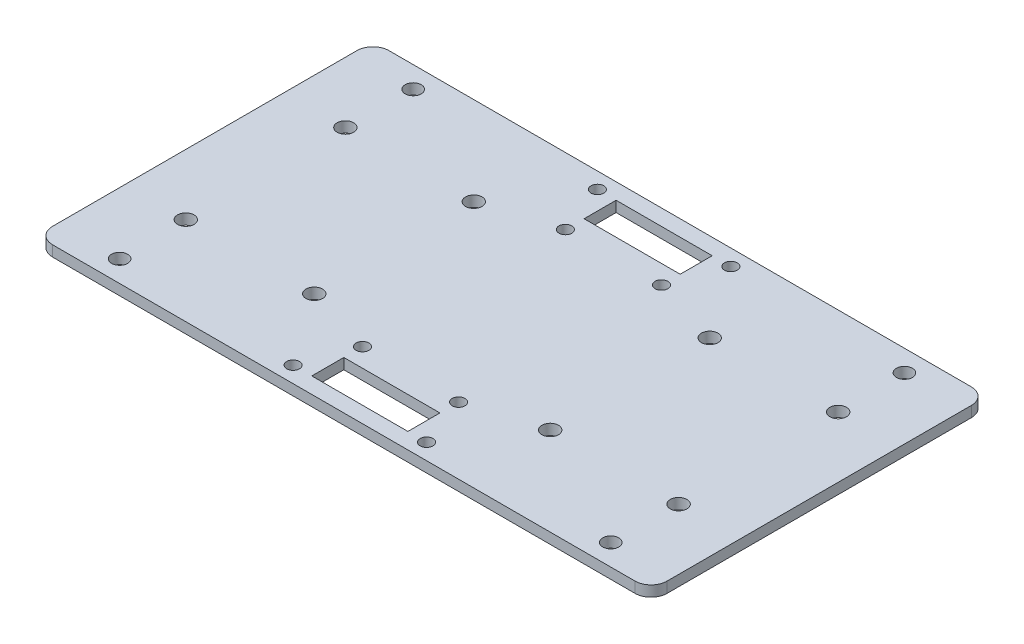
from build123d import *

# Parameters (mm, degrees)
ESBO_O1_W                = 115.09677689
ESBO_O1_H                = 63
RESSALTO_EXTRUS_O1_DEPTH = 2
ESBO_O2_R                = 1.55
CORTE_EXTRUS_O1_DEPTH    = 66.635866816
ESBO_O3_W                = 18
ESBO_O3_H                = 6
CORTE_EXTRUS_O2_DEPTH    = 66.635866816
FILETE1_R                = 3
ESBO_O8_R                = 1.2
CORTE_EXTRUS_O4_DEPTH    = 66.635866816
ESBO_O9_R                = 1.5
CORTE_EXTRUS_O5_DEPTH    = 66.635866816


with BuildPart() as part:
    # Esboço1 → Ressalto-extrusão1 (new body)
    with BuildSketch(Plane(origin=(0, 0, 0), x_dir=(1, 0, 0), z_dir=(0, 1, 0))):
        Rectangle(ESBO_O1_W, ESBO_O1_H)
    extrude(amount=RESSALTO_EXTRUS_O1_DEPTH)

    # Esboço2 → Corte-extrusão1 (cut, through all)
    with BuildSketch(Plane(origin=(0, 2, 0), x_dir=(1, 0, 0), z_dir=(0, 1, 0))):
        with Locations(Location((-46.153556516, -14.945, 0), (0, 0, 270))):
            Circle(ESBO_O2_R)
        with Locations(Location((-22.093556516, -14.94, 0), (0, 0, 270))):
            Circle(ESBO_O2_R)
        with Locations(Location((22.093556516, -14.94, 0), (0, 0, 90))):
            Circle(ESBO_O2_R)
        with Locations(Location((46.153556516, -14.945, 0), (0, 0, 90))):
            Circle(ESBO_O2_R)
        with Locations(Location((46.153556516, 14.945, 0), (0, 0, 270))):
            Circle(ESBO_O2_R)
        with Locations(Location((22.093556516, 14.94, 0), (0, 0, 270))):
            Circle(ESBO_O2_R)
        with Locations(Location((-22.093556516, 14.94, 0), (0, 0, 90))):
            Circle(ESBO_O2_R)
        with Locations(Location((-46.153556516, 14.945, 0), (0, 0, 90))):
            Circle(ESBO_O2_R)
    extrude(amount=-CORTE_EXTRUS_O1_DEPTH, mode=Mode.SUBTRACT)

    # Esboço3 → Corte-extrusão2 (cut, through all)
    with BuildSketch(Plane.XZ):
        with Locations((0, 25.5)):
            Rectangle(ESBO_O3_W, ESBO_O3_H)
        with Locations((0, -25.5)):
            Rectangle(ESBO_O3_W, ESBO_O3_H)
    extrude(amount=-CORTE_EXTRUS_O2_DEPTH, mode=Mode.SUBTRACT)

    # Filete1
    filete1_edges = [part.edges().sort_by_distance(p)[0] for p in [
        (-57.548388445, 1, -31.5),
        (57.548388445, 1, -31.5),
        (57.548388445, 1, 31.5),
        (-57.548388445, 1, 31.5),
    ]]
    fillet(filete1_edges, radius=FILETE1_R)

    # Esboço8 → Corte-extrusão4 (cut, through all)
    with BuildSketch(Plane(origin=(0, 2, 0), x_dir=(1, 0, 0), z_dir=(0, 1, 0))):
        with Locations(Location((-12.498388445, 28.5, 0), (0, 0, 270))):
            Circle(ESBO_O8_R)
        with Locations(Location((12.498388445, 28.5, 0), (0, 0, 90))):
            Circle(ESBO_O8_R)
        with Locations(Location((12.498388445, -28.5, 0), (0, 0, 270))):
            Circle(ESBO_O8_R)
        with Locations(Location((-12.498388445, -28.5, 0), (0, 0, 90))):
            Circle(ESBO_O8_R)
        with Locations(Location((-8.998388445, -19, 0), (0, 0, 270))):
            Circle(ESBO_O8_R)
        with Locations(Location((8.998388445, -19, 0), (0, 0, 90))):
            Circle(ESBO_O8_R)
        with Locations(Location((8.998388445, 19, 0), (0, 0, 270))):
            Circle(ESBO_O8_R)
        with Locations(Location((-8.998388445, 19, 0), (0, 0, 90))):
            Circle(ESBO_O8_R)
    extrude(amount=-CORTE_EXTRUS_O4_DEPTH, mode=Mode.SUBTRACT)

    # Esboço9 → Corte-extrusão5 (cut, through all)
    with BuildSketch(Plane(origin=(0, 2, 0), x_dir=(1, 0, 0), z_dir=(0, 1, 0))):
        with Locations(Location((-46, 27.5, 0), (0, 0, 270))):
            Circle(ESBO_O9_R)
        with Locations(Location((46, 27.5, 0), (0, 0, 90))):
            Circle(ESBO_O9_R)
        with Locations(Location((46, -27.5, 0), (0, 0, 270))):
            Circle(ESBO_O9_R)
        with Locations(Location((-46, -27.5, 0), (0, 0, 90))):
            Circle(ESBO_O9_R)
    extrude(amount=-CORTE_EXTRUS_O5_DEPTH, mode=Mode.SUBTRACT)


solid = part.part
